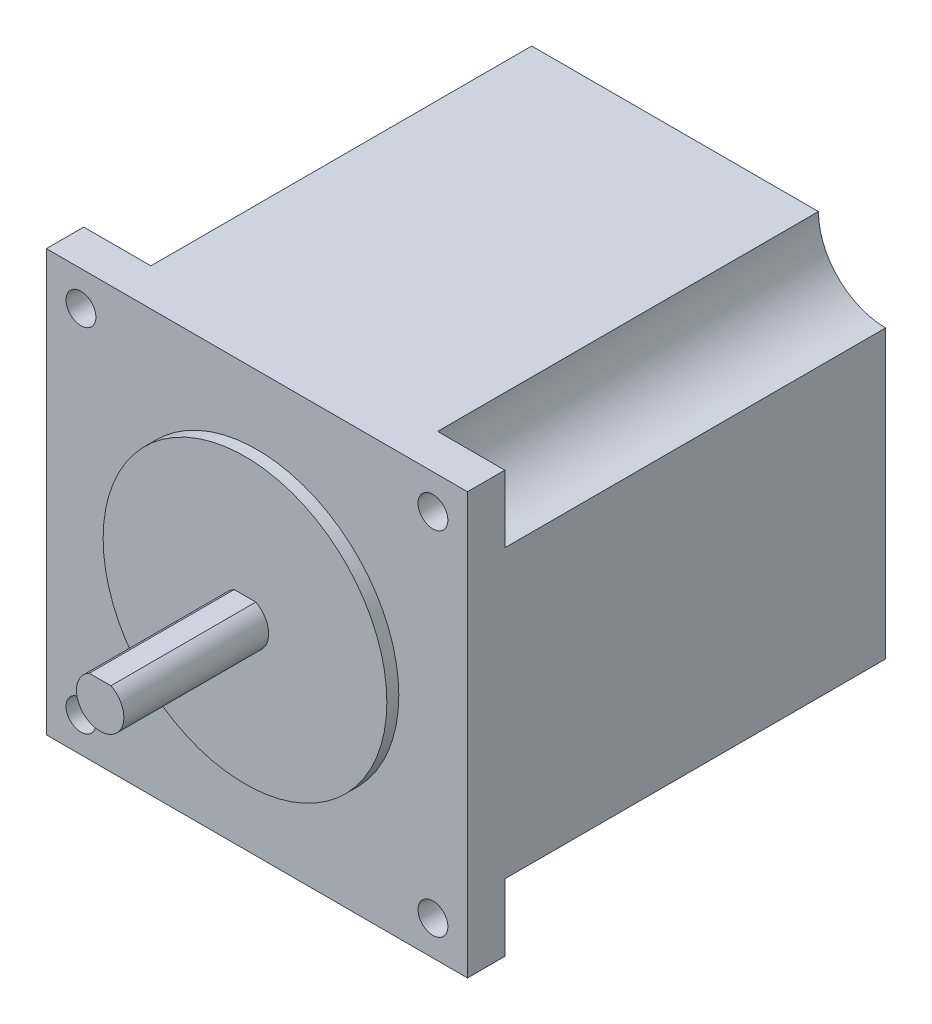
from build123d import *

# Parameters (mm, degrees)
SKETCH1_W           = 56.4
SKETCH1_H           = 56.4
BOSS_EXTRUDE1_DEPTH = 56
SKETCH2_R           = 19
BOSS_EXTRUDE2_DEPTH = 1.6
SKETCH3_R           = 3.175
BOSS_EXTRUDE3_DEPTH = 19.4
CUT_EXTRUDE1_DEPTH  = 19.4
SKETCH5_R           = 2
CUT_EXTRUDE2_DEPTH  = 69.749399997
SKETCH6_R           = 9
CUT_EXTRUDE3_DEPTH  = 51


with BuildPart() as part:
    # Sketch1 → Boss-Extrude1 (new body)
    with BuildSketch(Plane.XY):
        Rectangle(SKETCH1_W, SKETCH1_H)
    extrude(amount=BOSS_EXTRUDE1_DEPTH)

    # Sketch2 → Boss-Extrude2 (add)
    with BuildSketch(Plane.XY.offset(56)):
        Circle(SKETCH2_R)
    extrude(amount=BOSS_EXTRUDE2_DEPTH)

    # Sketch3 → Boss-Extrude3 (add)
    with BuildSketch(Plane.XY.offset(57.6)):
        Circle(SKETCH3_R)
    extrude(amount=BOSS_EXTRUDE3_DEPTH)

    # Sketch4 → Cut-Extrude1 (cut)
    with BuildSketch(Plane.XY.offset(77)):
        Polygon((-97.277384537, 2.825), (-1.449137675, 2.825), (1.449137675, 2.825), (97.277384537, 2.825), (97.277384537, 194.481493724), (-97.277384537, 194.481493724), align=None)
    extrude(amount=-CUT_EXTRUDE1_DEPTH, mode=Mode.SUBTRACT)

    # Sketch5 → Cut-Extrude2 (cut, through all)
    with BuildSketch(Plane.XY.offset(56)):
        with Locations((23.57, 23.57)):
            Circle(SKETCH5_R)
        with Locations(Location((-23.57, 23.57, 0), (0, 0, 180))):
            Circle(SKETCH5_R)
        with Locations(Location((23.57, -23.57, 0), (0, 0, 180))):
            Circle(SKETCH5_R)
        with Locations((-23.57, -23.57)):
            Circle(SKETCH5_R)
    extrude(amount=-CUT_EXTRUDE2_DEPTH, mode=Mode.SUBTRACT)

    # Sketch6 → Cut-Extrude3 (cut)
    with BuildSketch(Plane(origin=(0, 0, 0), x_dir=(-1, 0, 0), z_dir=(0, 0, -1))):
        with Locations((-28.2, 28.2)):
            Circle(SKETCH6_R)
        with Locations((-28.2, -28.2)):
            Circle(SKETCH6_R)
        with Locations((28.2, -28.2)):
            Circle(SKETCH6_R)
        with Locations((28.2, 28.2)):
            Circle(SKETCH6_R)
    extrude(amount=-CUT_EXTRUDE3_DEPTH, mode=Mode.SUBTRACT)


solid = part.part
